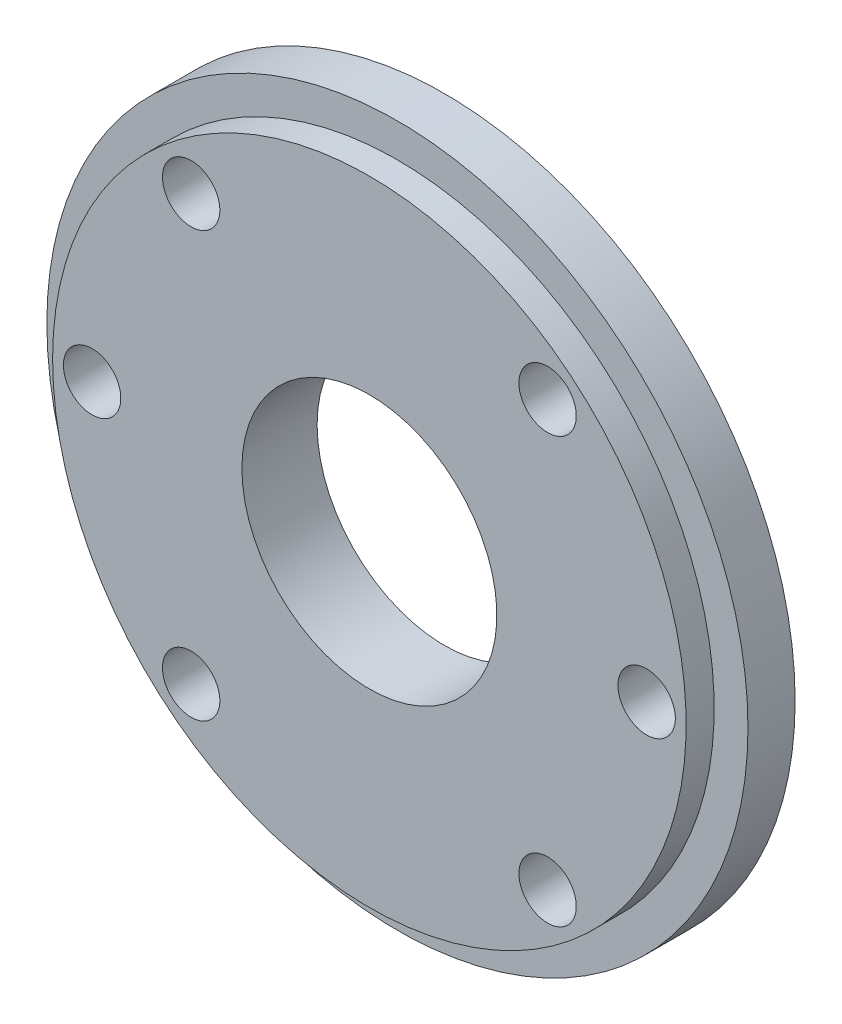
from build123d import *

# Parameters (mm, degrees)
SKETCH_1_R          = 24.85
SKETCH_1_R_2        = 2.25
EXTRUDE_1_DEPTH     = 6.5
SKETCH_3_R          = 27.5
SKETCH_3_R_2        = 24.85
EXTRUDE_2_DEPTH     = 4.3
SKETCH_4_R          = 27.5
CUT_EXTRUDE_1_DEPTH = 0.6
SKETCH_5_R          = 10
CUT_EXTRUDE_2_DEPTH = 40.335861501


with BuildPart() as part:
    # 草图1 → 凸台-拉伸1 (new body)
    with BuildSketch(Plane.XY):
        with Locations(Location((0, 0, 0), (0, 0, 180))):
            Circle(SKETCH_1_R)
        with Locations(Location((-21.75, 0, 0), (0, 0, 180))):
            Circle(SKETCH_1_R_2, mode=Mode.SUBTRACT)
        with Locations(Location((-13.980630511, 16.661466638, 0), (0, 0, 180))):
            Circle(SKETCH_1_R_2, mode=Mode.SUBTRACT)
        with Locations(Location((-13.980630511, -16.661466638, 0), (0, 0, 180))):
            Circle(SKETCH_1_R_2, mode=Mode.SUBTRACT)
        with Locations(Location((13.980630511, -16.661466638, 0), (0, 0, 180))):
            Circle(SKETCH_1_R_2, mode=Mode.SUBTRACT)
        with Locations(Location((21.75, 0, 0), (0, 0, 180))):
            Circle(SKETCH_1_R_2, mode=Mode.SUBTRACT)
        with Locations(Location((13.980630511, 16.661466638, 0), (0, 0, 180))):
            Circle(SKETCH_1_R_2, mode=Mode.SUBTRACT)
    extrude(amount=EXTRUDE_1_DEPTH)

    # 草图3 → 凸台-拉伸2 (add)
    with BuildSketch(Plane.XY):
        with Locations(Location((0, 0, 0), (0, 0, 180))):
            Circle(SKETCH_3_R)
        with Locations(Location((0, 0, 0), (0, 0, 180))):
            Circle(SKETCH_3_R_2, mode=Mode.SUBTRACT)
    extrude(amount=EXTRUDE_2_DEPTH)

    # 草图4 → 切除-拉伸1 (cut)
    with BuildSketch(Plane(origin=(0, 0, 0), x_dir=(-1, 0, 0), z_dir=(0, 0, -1))):
        Circle(SKETCH_4_R)
    extrude(amount=-CUT_EXTRUDE_1_DEPTH, mode=Mode.SUBTRACT)

    # 草图5 → 切除-拉伸2 (cut, through all)
    with BuildSketch(Plane(origin=(0, 0, 0.6), x_dir=(-1, 0, 0), z_dir=(0, 0, -1))):
        Circle(SKETCH_5_R)
    extrude(amount=-CUT_EXTRUDE_2_DEPTH, mode=Mode.SUBTRACT)


solid = part.part
